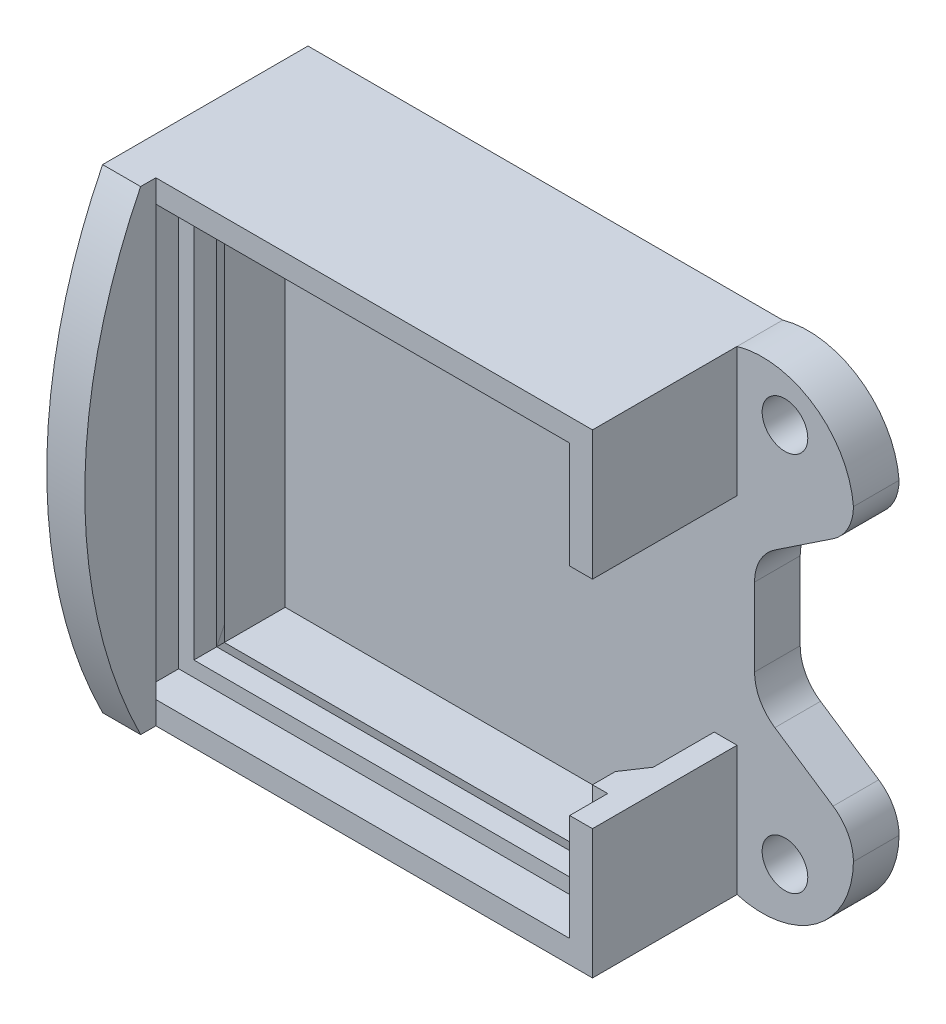
from build123d import *

# Parameters (mm, degrees)
CROQUIS1_R              = 1.5
SALIENTE_EXTRUIR1_DEPTH = 3
CROQUIS2_W              = 31.2
CROQUIS2_H              = 31.2
CROQUIS2_W_2            = 28.2
CROQUIS2_H_2            = 28.2
SALIENTE_EXTRUIR2_DEPTH = 9.5
CROQUIS4_W              = 28.2
CROQUIS4_H              = 28.2
CROQUIS4_W_2            = 26.2
CROQUIS4_H_2            = 26.2
SALIENTE_EXTRUIR3_DEPTH = 3
CORTAR_EXTRUIR1_REACH   = 69.732
CROQUIS8_W              = 7.2
CROQUIS8_H              = 1
CORTAR_EXTRUIR2_START   = -9.5
CROQUIS9_W              = 5.627722912
CROQUIS9_H              = 14.2
CORTAR_EXTRUIR2_DEPTH   = 9.5
CROQUIS10_W             = 2.5
CROQUIS10_H             = 31.2
SALIENTE_EXTRUIR4_DEPTH = 1
CORTAR_EXTRUIR3_DEPTH   = 3
SALIENTE_EXTRUIR5_START = -2.5
SALIENTE_EXTRUIR5_DEPTH = 2.5


with BuildPart() as part:
    # Croquis1 → Saliente-Extruir1 (new body)
    with BuildSketch(Plane.XY):
        with BuildLine():
            Line((-52.197309417, 4.461883408), (-50.197309417, 4.461883408))
            Line((-50.197309417, 4.461883408), (-44.197309417, 8.461883408))
            Line((-44.197309417, 8.461883408), (-44.197309417, 24.461883408))
            Line((-44.197309417, 24.461883408), (-50.197309417, 28.461883408))
            Line((-50.197309417, 28.461883408), (-52.197309417, 28.461883408))
            ThreePointArc((-52.197309417, 28.461883408), (-56.197309417, 32.461883408), (-52.197309417, 36.461883408))
            Line((-52.197309417, 36.461883408), (-5.197309417, 36.461883408))
            ThreePointArc((-5.197309417, 36.461883408), (-3.075989073, 35.583203752), (-2.197309417, 33.461883408))
            Line((-2.197309417, 33.461883408), (-2.197309417, 26.567434684))
            ThreePointArc((-2.197309417, 26.567434684), (-2.552285621, 25.151860907), (-3.533208828, 24.071283801))
            Line((-3.533208828, 24.071283801), (-7.361410006, 21.519149682))
            ThreePointArc((-7.361410006, 21.519149682), (-8.342333213, 20.438572576), (-8.697309417, 19.022998799))
            Line((-8.697309417, 19.022998799), (-8.697309417, 13.900768017))
            ThreePointArc((-8.697309417, 13.900768017), (-8.342333213, 12.48519424), (-7.361410006, 11.404617134))
            Line((-7.361410006, 11.404617134), (-3.533208828, 8.852483016))
            ThreePointArc((-3.533208828, 8.852483016), (-2.552285621, 7.771905909), (-2.197309417, 6.356332133))
            Line((-2.197309417, 6.356332133), (-2.197309417, -0.538116592))
            ThreePointArc((-2.197309417, -0.538116592), (-3.075989073, -2.659436935), (-5.197309417, -3.538116592))
            Line((-5.197309417, -3.538116592), (-52.197309417, -3.538116592))
            ThreePointArc((-52.197309417, -3.538116592), (-56.197309417, 0.461883408), (-52.197309417, 4.461883408))
        make_face()
        with Locations((-6.697309417, 28.961883408)):
            Circle(CROQUIS1_R, mode=Mode.SUBTRACT)
        with Locations((-52.197309417, 0.461883408)):
            Circle(CROQUIS1_R, mode=Mode.SUBTRACT)
        with Locations((-6.697309417, 3.961883408)):
            Circle(CROQUIS1_R, mode=Mode.SUBTRACT)
        with Locations((-52.197309417, 32.461883408)):
            Circle(CROQUIS1_R, mode=Mode.SUBTRACT)
    extrude(amount=SALIENTE_EXTRUIR1_DEPTH)

    # Croquis2 → Saliente-Extruir2 (add)
    with BuildSketch(Plane.XY.offset(3)):
        with Locations((-25.447309417, 16.261883408)):
            Rectangle(CROQUIS2_W, CROQUIS2_H)
        with Locations((-25.447309417, 16.261883408)):
            Rectangle(CROQUIS2_W_2, CROQUIS2_H_2, mode=Mode.SUBTRACT)
    extrude(amount=SALIENTE_EXTRUIR2_DEPTH)

    # Croquis4 → Saliente-Extruir3 (add)
    with BuildSketch(Plane.XY.offset(7)):
        with Locations((-25.447309417, 16.261883408)):
            Rectangle(CROQUIS4_W, CROQUIS4_H)
        with Locations((-25.447309417, 16.261883408)):
            Rectangle(CROQUIS4_W_2, CROQUIS4_H_2, mode=Mode.SUBTRACT)
    extrude(amount=SALIENTE_EXTRUIR3_DEPTH)

    # Cortar-Barrer1: sweep along a path in Croquis7
    with BuildLine(Plane.XY.offset(10)) as cortar_barrer1_path:
        Line((-39.047309417, 29.861883408), (-11.847309417, 29.861883408))
        Line((-11.847309417, 29.861883408), (-11.847309417, 2.661883408))
        Line((-11.847309417, 2.661883408), (-39.047309417, 2.661883408))
        Line((-39.047309417, 2.661883408), (-39.047309417, 29.861883408))
    # Croquis6 → Cortar-Barrer1 (sweep, cut)
    with BuildSketch(Plane(origin=(0, 3.161883408, 0), x_dir=(-1, 0, 0), z_dir=(0, -1, 0))):
        Polygon((38.547309417, -8.5), (38.547309417, -7), (39.547309417, -7), align=None)
    sweep(path=cortar_barrer1_path.line, transition=Transition.RIGHT, mode=Mode.SUBTRACT)

    # Cortar-Extruir1: up to this plane
    cortar_extruir1_end = Plane(origin=(-39.697309417, 30.361883408, 7), z_dir=(0, -0.8320502943378436, -0.5547001962252293))
    # Croquis8 → Cortar-Extruir1 (cut, up to the surface)
    with BuildSketch(Plane.XY.offset(10), mode=Mode.PRIVATE) as cortar_extruir1_sk1:
        with Locations((-26.947309417, 29.861883408)):
            Rectangle(CROQUIS8_W, CROQUIS8_H)
    cortar_extruir1_tool1 = split(extrude(cortar_extruir1_sk1.sketch, amount=-CORTAR_EXTRUIR1_REACH, mode=Mode.PRIVATE), bisect_by=cortar_extruir1_end, keep=Keep.BOTH, mode=Mode.PRIVATE)
    add(cortar_extruir1_tool1.solids().sort_by_distance((-26.947309, 29.861883, 10))[0], mode=Mode.SUBTRACT)

    # Croquis9 → Cortar-Extruir2 (cut)
    with BuildSketch(Plane.XY.offset(12.5).offset(CORTAR_EXTRUIR2_START)):
        with Locations((-12.661170873, 16.261883408)):
            Rectangle(CROQUIS9_W, CROQUIS9_H)
    extrude(amount=CORTAR_EXTRUIR2_DEPTH, mode=Mode.SUBTRACT)

    # Croquis10 → Saliente-Extruir4 (add)
    with BuildSketch(Plane.XY.offset(12.5)):
        with Locations((-39.797309417, 16.261883408)):
            Rectangle(CROQUIS10_W, CROQUIS10_H)
    extrude(amount=SALIENTE_EXTRUIR4_DEPTH)

    # Croquis12 → Cortar-Extruir3 (cut)
    with BuildSketch(Plane.XY.offset(3)):
        with BuildLine():
            Line((-9.847309417, 31.861883408), (-41.047309417, 31.861883408))
            Line((-41.047309417, 31.861883408), (-41.047309417, 0.661883408))
            Line((-41.047309417, 0.661883408), (-9.847309417, 0.661883408))
            ThreePointArc((-9.847309417, 0.661883408), (-4.614210238, 1.617448149), (-2.197309417, 6.356332133))
            Line((-2.197309417, 6.356332133), (-2.197309417, -17.8731401))
            Line((-2.197309417, -17.8731401), (-65.359464881, -17.8731401))
            Line((-65.359464881, -17.8731401), (-65.359464881, 40.399106007))
            Line((-65.359464881, 40.399106007), (-2.197309417, 40.399106007))
            Line((-2.197309417, 40.399106007), (-2.197309417, 26.567434684))
            ThreePointArc((-2.197309417, 26.567434684), (-4.764439849, 31.03216691), (-9.847309417, 31.861883408))
        make_face()
    extrude(amount=-CORTAR_EXTRUIR3_DEPTH, mode=Mode.SUBTRACT)

    # Croquis13 → Saliente-Extruir5 (add)
    with BuildSketch(Plane.ZY.offset(41.047309417).offset(SALIENTE_EXTRUIR5_START)):
        with BuildLine():
            Line((13.5, 31.861883408), (13.5, 0.661883408))
            ThreePointArc((13.5, 0.661883408), (17.168865325, 16.261883408), (13.5, 31.861883408))
        make_face()
    extrude(amount=SALIENTE_EXTRUIR5_DEPTH)


solid = part.part
